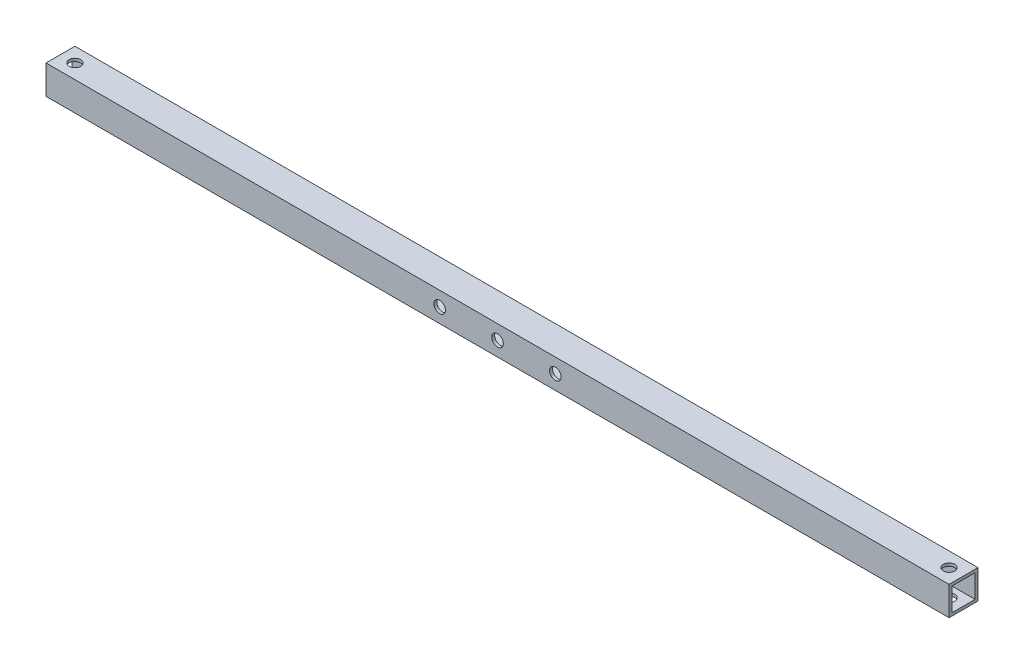
from build123d import *

# Parameters (mm, degrees)
SKETCH_1_W          = 10
SKETCH_1_H          = 10
SKETCH_1_W_2        = 8
SKETCH_1_H_2        = 8
EXTRUDE_1_DEPTH     = 312
SKETCH_2_R          = 2
CUT_EXTRUDE_1_DEPTH = 313.200256246
SKETCH_3_R          = 2
CUT_EXTRUDE_2_DEPTH = 313.200256246


with BuildPart() as part:
    # ｽｹｯﾁ1 → 押し出し-薄板1 (new body)
    with BuildSketch(Plane(origin=(0, 0, 0), x_dir=(0, 0, -1), z_dir=(1, 0, 0))):
        Rectangle(SKETCH_1_W, SKETCH_1_H)
        Rectangle(SKETCH_1_W_2, SKETCH_1_H_2, mode=Mode.SUBTRACT)
    extrude(amount=EXTRUDE_1_DEPTH)

    # ｽｹｯﾁ2 → ｶｯﾄ - 押し出し1 (cut, through all)
    with BuildSketch(Plane(origin=(0, 5, 0), x_dir=(1, 0, 0), z_dir=(0, 1, 0))):
        with Locations(Location((5, 0, 0), (0, 0, 270))):
            Circle(SKETCH_2_R)
        with Locations(Location((307, 0, 0), (0, 0, 270))):
            Circle(SKETCH_2_R)
    extrude(amount=-CUT_EXTRUDE_1_DEPTH, mode=Mode.SUBTRACT)

    # ｽｹｯﾁ3 → ｶｯﾄ - 押し出し2 (cut, through all)
    with BuildSketch(Plane.XY.offset(5)):
        with Locations((136, 0)):
            Circle(SKETCH_3_R)
        with Locations((156, 0)):
            Circle(SKETCH_3_R)
        with Locations((176, 0)):
            Circle(SKETCH_3_R)
    extrude(amount=-CUT_EXTRUDE_2_DEPTH, mode=Mode.SUBTRACT)


solid = part.part
